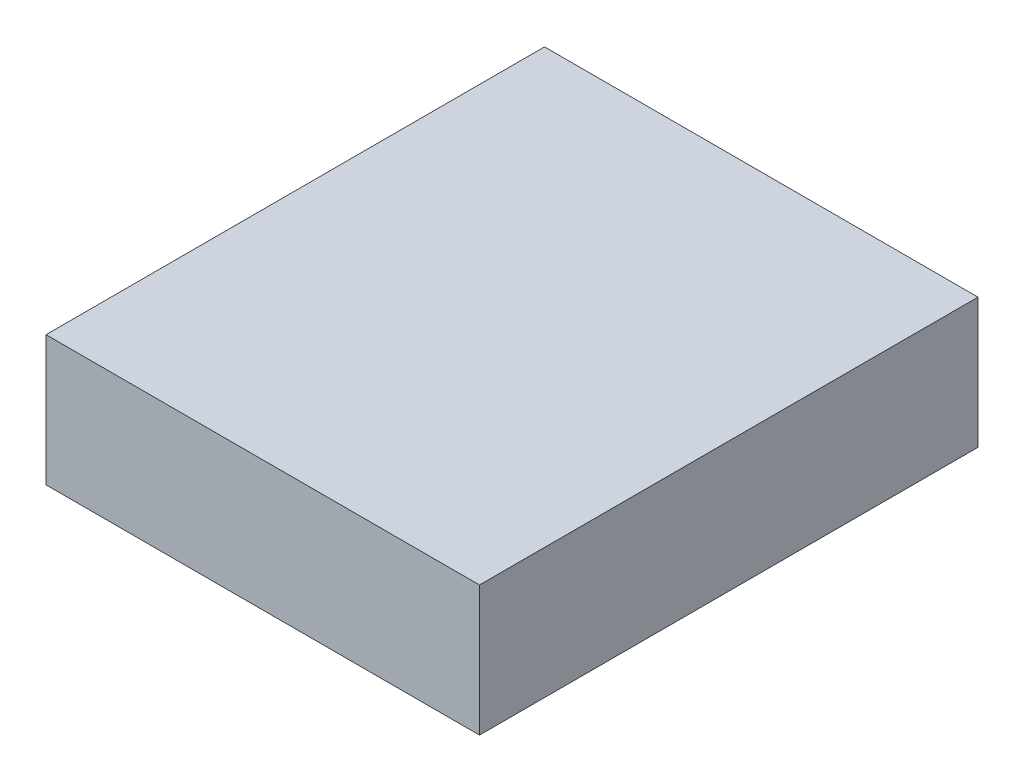
from build123d import *

# Parameters (mm, degrees)
SKETCH1_W           = 127
SKETCH1_H           = 146.05
BOSS_EXTRUDE1_DEPTH = 38.1


with BuildPart() as part:
    # Sketch1 → Boss-Extrude1 (new body)
    with BuildSketch(Plane(origin=(0, 0, 0), x_dir=(1, 0, 0), z_dir=(0, 1, 0))):
        Rectangle(SKETCH1_W, SKETCH1_H)
    extrude(amount=BOSS_EXTRUDE1_DEPTH)


solid = part.part
